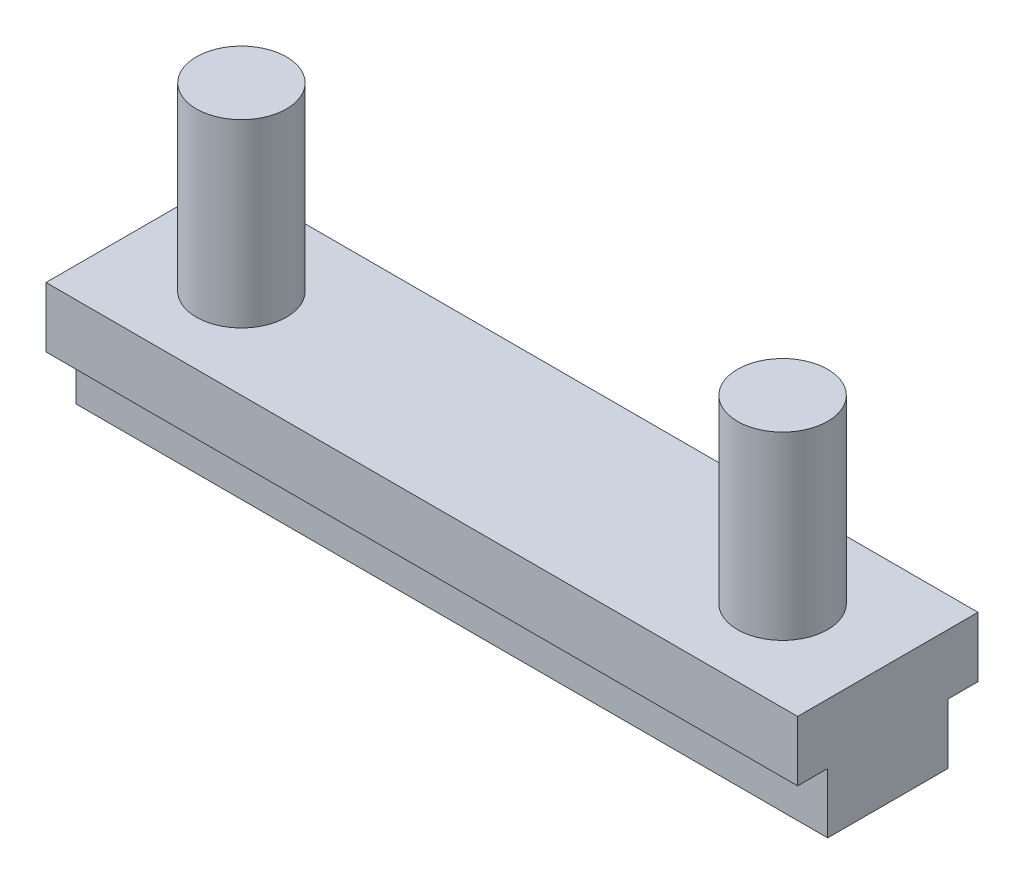
from build123d import *

# Parameters (mm, degrees)
SKETCH1_W           = 125
SKETCH1_H           = 30
SKETCH1_R           = 7.5
BOSS_EXTRUDE1_DEPTH = 10
SKETCH3_W           = 125
SKETCH3_H           = 20
BOSS_EXTRUDE2_DEPTH = 10
SKETCH4_R           = 7.5
BOSS_EXTRUDE3_DEPTH = 40


with BuildPart() as part:
    # Sketch1 → Boss-Extrude1 (new body)
    with BuildSketch(Plane(origin=(0, 0, 0), x_dir=(1, 0, 0), z_dir=(0, 1, 0))):
        Rectangle(SKETCH1_W, SKETCH1_H)
        with Locations(Location((-45, 0, 0), (0, 0, 270))):
            Circle(SKETCH1_R, mode=Mode.SUBTRACT)
        with Locations(Location((45, 0, 0), (0, 0, 270))):
            Circle(SKETCH1_R, mode=Mode.SUBTRACT)
    extrude(amount=BOSS_EXTRUDE1_DEPTH)

    # Sketch3 → Boss-Extrude2 (add)
    with BuildSketch(Plane.XZ):
        Rectangle(SKETCH3_W, SKETCH3_H)
    extrude(amount=BOSS_EXTRUDE2_DEPTH)

    # Sketch4 → Boss-Extrude3 (add)
    with BuildSketch(Plane(origin=(0, 0, 0), x_dir=(1, 0, 0), z_dir=(0, 1, 0))):
        with Locations(Location((45, 0, 0), (0, 0, 270))):
            Circle(SKETCH4_R)
        with Locations(Location((-45, 0, 0), (0, 0, 270))):
            Circle(SKETCH4_R)
    extrude(amount=BOSS_EXTRUDE3_DEPTH)


solid = part.part
